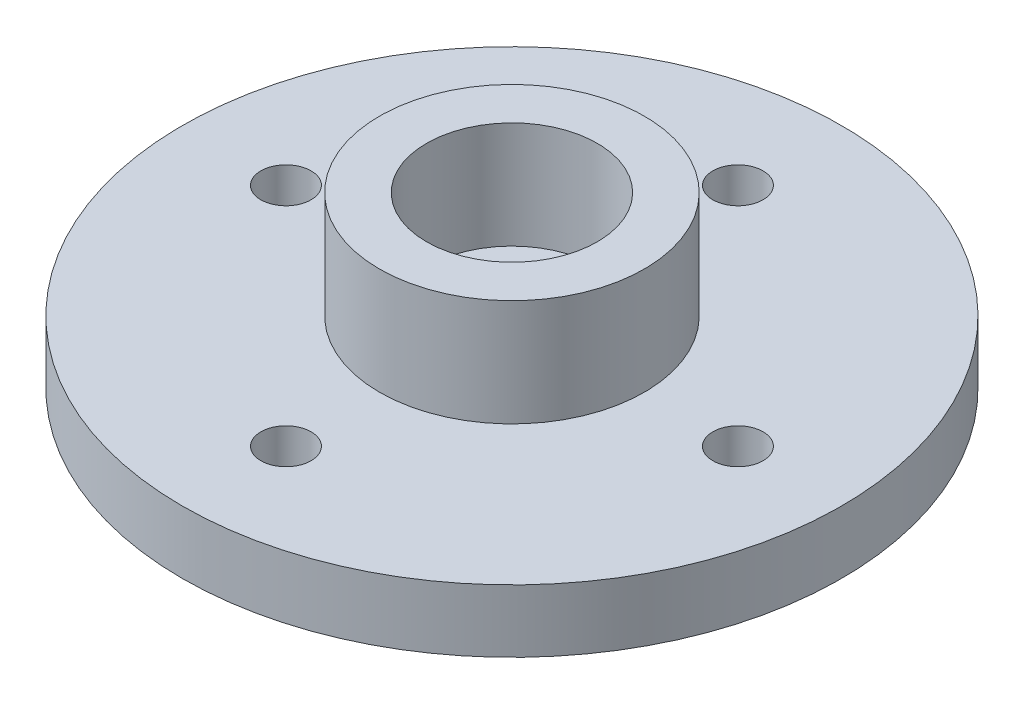
from build123d import *

# Parameters (mm, degrees)
SKETCH1_R           = 10.5
SKETCH1_R_2         = 0.8
BOSS_EXTRUDE1_DEPTH = 2
SKETCH2_R           = 1.5
CUT_EXTRUDE1_DEPTH  = 2
SKETCH2_3_R         = 4.22
SKETCH2_3_R_2       = 2.72
BOSS_EXTRUDE2_DEPTH = 3.4


with BuildPart() as part:
    # Sketch1 → Boss-Extrude1 (new body)
    with BuildSketch(Plane(origin=(0, 0, 0), x_dir=(1, 0, 0), z_dir=(0, 1, 0))):
        Circle(SKETCH1_R)
        with Locations((0, 7.2)):
            Circle(SKETCH1_R_2, mode=Mode.SUBTRACT)
        with Locations((7.2, 0)):
            Circle(SKETCH1_R_2, mode=Mode.SUBTRACT)
        with Locations((0, -7.2)):
            Circle(SKETCH1_R_2, mode=Mode.SUBTRACT)
        with Locations((-7.2, 0)):
            Circle(SKETCH1_R_2, mode=Mode.SUBTRACT)
    extrude(amount=BOSS_EXTRUDE1_DEPTH)

    # Sketch2 → Cut-Extrude1 (cut)
    with BuildSketch(Plane(origin=(0, 2, 0), x_dir=(1, 0, 0), z_dir=(0, 1, 0))):
        Circle(SKETCH2_R)
    extrude(amount=-CUT_EXTRUDE1_DEPTH, mode=Mode.SUBTRACT)

    # Sketch2<3> → Boss-Extrude2 (add)
    with BuildSketch(Plane(origin=(0, 2, 0), x_dir=(1, 0, 0), z_dir=(0, 1, 0))):
        Circle(SKETCH2_3_R)
        Circle(SKETCH2_3_R_2, mode=Mode.SUBTRACT)
    extrude(amount=BOSS_EXTRUDE2_DEPTH)


solid = part.part
